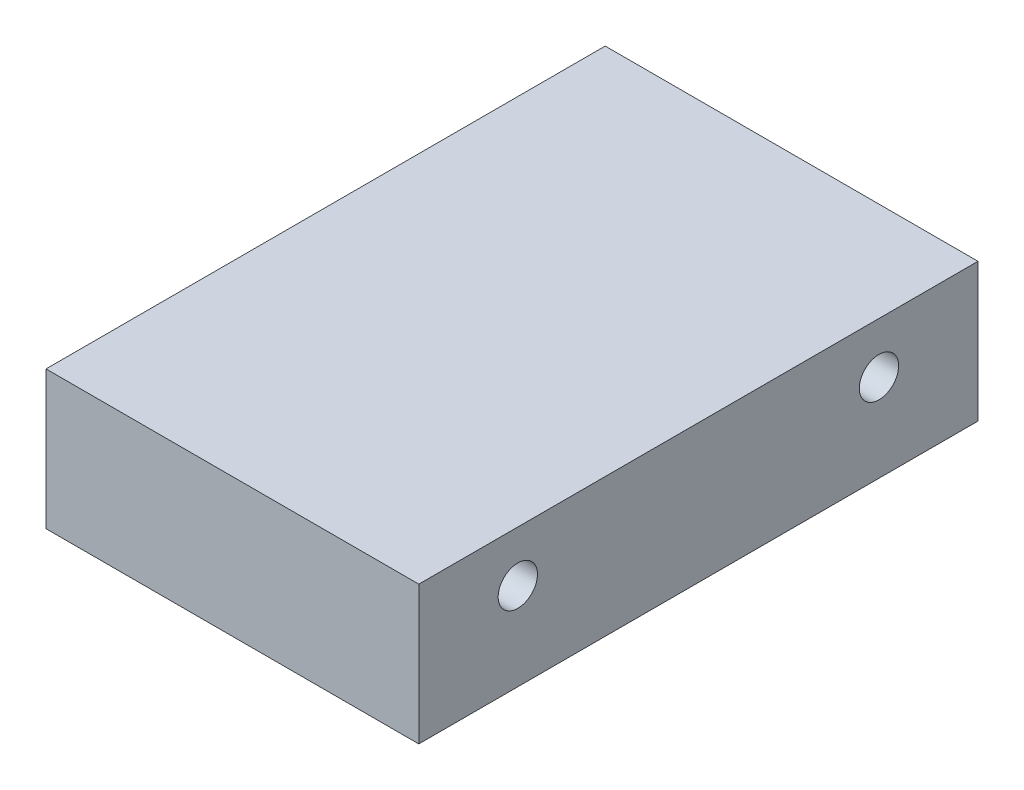
from build123d import *

# Parameters (mm, degrees)
SKETCH1_W           = 101.6
SKETCH1_H           = 152.4
BOSS_EXTRUDE1_DEPTH = 37.719
SKETCH2_R           = 5.35813
CUT_EXTRUDE1_DEPTH  = 133.482915733


with BuildPart() as part:
    # Sketch1 → Boss-Extrude1 (new body)
    with BuildSketch(Plane(origin=(0, 0, 0), x_dir=(1, 0, 0), z_dir=(0, 1, 0))):
        Rectangle(SKETCH1_W, SKETCH1_H)
    extrude(amount=BOSS_EXTRUDE1_DEPTH)

    # Sketch2 → Cut-Extrude1 (cut, through all)
    with BuildSketch(Plane(origin=(50.8, 0, 0), x_dir=(0, 0, -1), z_dir=(1, 0, 0))):
        with Locations((-49.2125, 23.876)):
            Circle(SKETCH2_R)
        with Locations((49.2125, 23.876)):
            Circle(SKETCH2_R)
    extrude(amount=-CUT_EXTRUDE1_DEPTH, mode=Mode.SUBTRACT)


solid = part.part
